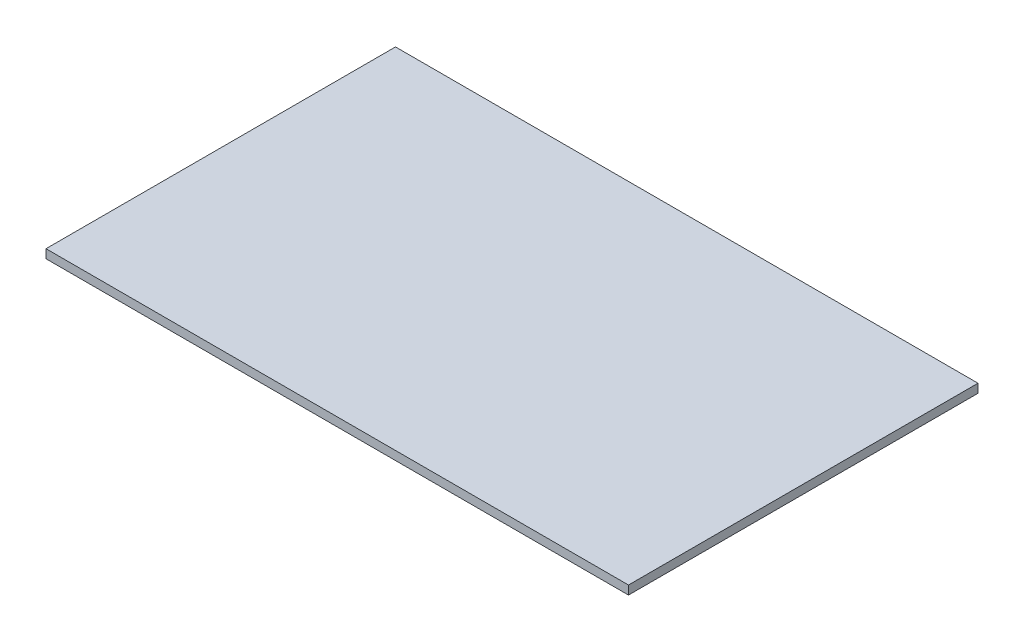
from build123d import *

# Parameters (mm, degrees)
SKETCH2_W           = 508
SKETCH2_H           = 304.8
BOSS_EXTRUDE1_DEPTH = 7.62


with BuildPart() as part:
    # Sketch2 → Boss-Extrude1 (new body)
    with BuildSketch(Plane(origin=(0, 0, 0), x_dir=(1, 0, 0), z_dir=(0, 1, 0))):
        with Locations((254, 152.4)):
            Rectangle(SKETCH2_W, SKETCH2_H)
    extrude(amount=BOSS_EXTRUDE1_DEPTH)


solid = part.part
